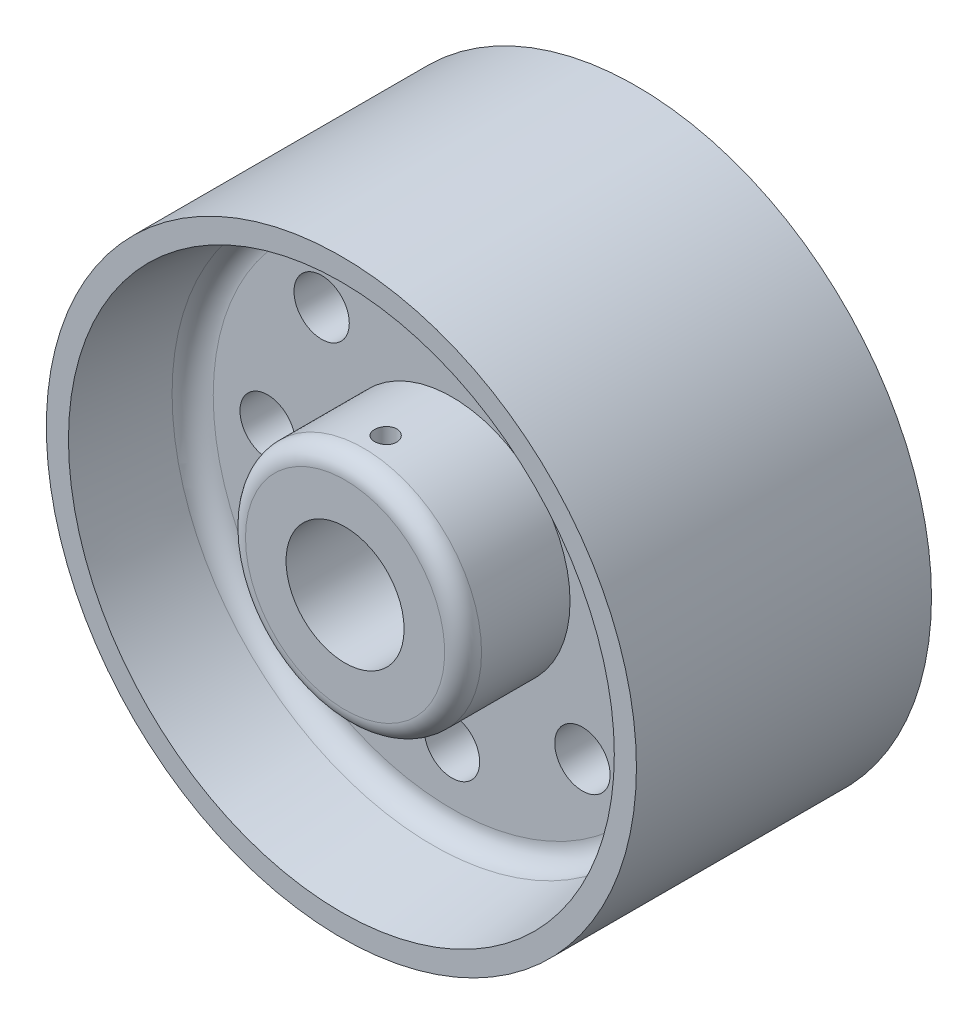
from build123d import *

# Parameters (mm, degrees)
SKETCH2_R               = 3.75
CUT_EXTRUDE1_DEPTH      = 59.523499554
CUT_EXTRUDE2_REACH      = 62
CUT_EXTRUDE2_END_RADIUS = 16
SKETCH3_R               = 1.5
FILLET1_R               = 3
FILLET3_R               = 2.5
FILLET1_OF_MIRROR1_R    = 3
FILLET3_OF_MIRROR1_R    = 2.5


with BuildPart() as part:
    # Sketch1 → Revolve1 (revolve)
    with BuildSketch(Plane(origin=(0, 0, 0), x_dir=(0, 0, -1), z_dir=(1, 0, 0)), mode=Mode.PRIVATE) as revolve1_sk:
        Polygon((0, 8), (0, 40), (-20, 40), (-20, 37), (-5, 35), (-5, 16), (-19.5, 16), (-19.5, 8), align=None)
    revolve1 = revolve(revolve1_sk.sketch.rotate(Axis((0, 0, 30), (0, 0, -1)), 90), axis=Axis((0, 0, 30), (0, 0, -1)))

    # Sketch2 → Cut-Extrude1 (cut, through all)
    with BuildSketch(Plane.XY.offset(5)):
        with Locations((0, 25)):
            Circle(SKETCH2_R)
        with Locations((17.67766953, 17.67766953)):
            Circle(SKETCH2_R)
        with Locations((25, 0)):
            Circle(SKETCH2_R)
        with Locations((17.67766953, -17.67766953)):
            Circle(SKETCH2_R)
        with Locations((0, -25)):
            Circle(SKETCH2_R)
        with Locations((-17.67766953, -17.67766953)):
            Circle(SKETCH2_R)
        with Locations((-25, 0)):
            Circle(SKETCH2_R)
        with Locations((-17.67766953, 17.67766953)):
            Circle(SKETCH2_R)
    cut_extrude1 = extrude(amount=-CUT_EXTRUDE1_DEPTH, mode=Mode.SUBTRACT)

    # Cut-Extrude2: up to this cylinder (the profile starts inside it)
    cut_extrude2_end = Plane(origin=(0, 0, 14), z_dir=(0, 0, 1)) * Cylinder(CUT_EXTRUDE2_END_RADIUS, 157, mode=Mode.PRIVATE)
    # Sketch3 → Cut-Extrude2 (cut, up to the surface)
    with BuildSketch(Plane(origin=(0, 0, 0), x_dir=(1, 0, 0), z_dir=(0, 1, 0)), mode=Mode.PRIVATE) as cut_extrude2_sk1:
        with Locations(Location((0, -14, 0), (0, 0, 90))):
            Circle(SKETCH3_R)
    cut_extrude2_tool1 = extrude(cut_extrude2_sk1.sketch, amount=CUT_EXTRUDE2_REACH, mode=Mode.PRIVATE) & cut_extrude2_end
    cut_extrude2 = cut_extrude2_tool1.solids().sort_by_distance((0, 0, 14))[0]
    add(cut_extrude2, mode=Mode.SUBTRACT)

    # Fillet1
    fillet1_edges = [part.edges().sort_by_distance(p)[0] for p in [
        (-35, 0, 5),
    ]]
    fillet(fillet1_edges, radius=FILLET1_R)

    # Fillet3
    fillet3_edges = [part.edges().sort_by_distance(p)[0] for p in [
        (-16, 0, 19.5),
    ]]
    fillet(fillet3_edges, radius=FILLET3_R)

    # Mirror1: Revolve1, Cut-Extrude1, Cut-Extrude2 across plane
    add(revolve1.mirror(Plane.XY))
    add(cut_extrude1.mirror(Plane.XY), mode=Mode.SUBTRACT)
    add(cut_extrude2.mirror(Plane.XY), mode=Mode.SUBTRACT)

    # Fillet1 of Mirror1
    fillet1_of_mirror1_edges = [part.edges().sort_by_distance(p)[0] for p in [
        (-35, 0, -5),
    ]]
    fillet(fillet1_of_mirror1_edges, radius=FILLET1_OF_MIRROR1_R)

    # Fillet3 of Mirror1
    fillet3_of_mirror1_edges = [part.edges().sort_by_distance(p)[0] for p in [
        (-16, 0, -19.5),
    ]]
    fillet(fillet3_of_mirror1_edges, radius=FILLET3_OF_MIRROR1_R)


solid = part.part
